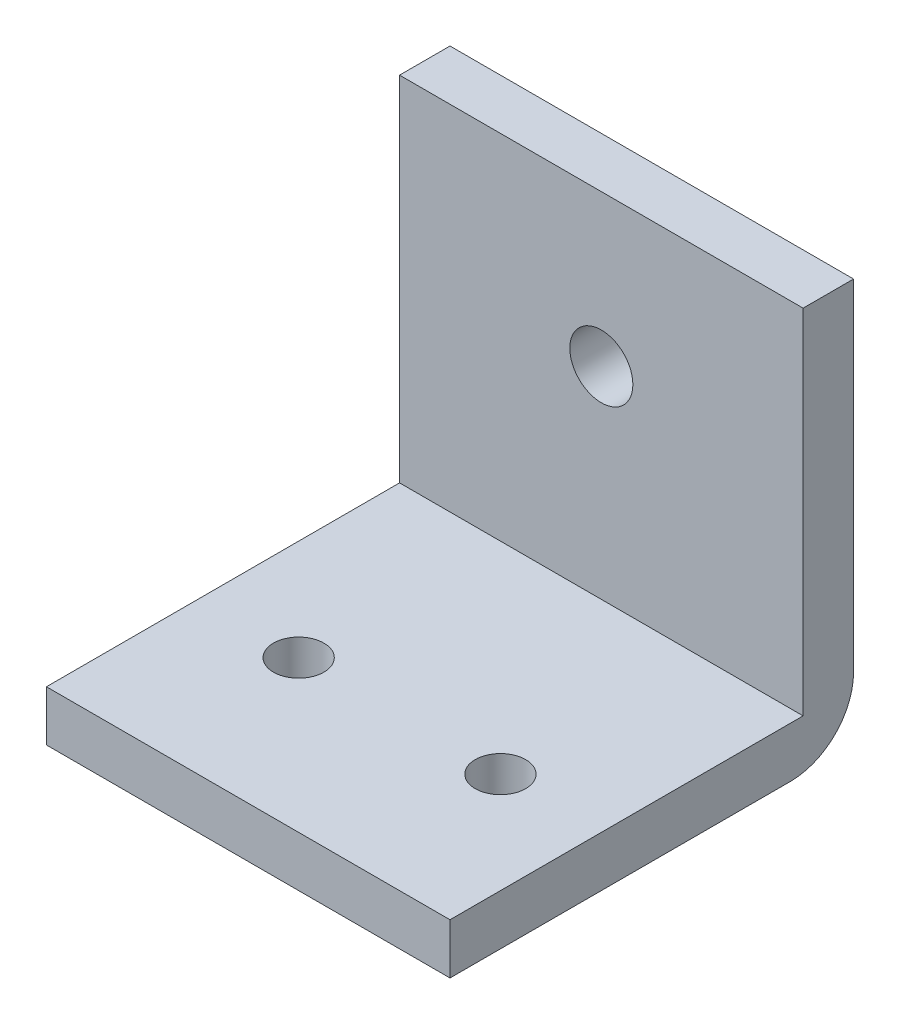
from build123d import *

# Parameters (mm, degrees)
SKETCH1_W           = 40
SKETCH1_H           = 35
SKETCH1_R           = 3.125
BOSS_EXTRUDE1_DEPTH = 5
SKETCH1_3_W         = 40
SKETCH1_3_H         = 5
BOSS_EXTRUDE2_DEPTH = 40
FILLET1_R           = 6.25
SKETCH2_R           = 2.5
CUT_EXTRUDE1_DEPTH  = 67.520673478


with BuildPart() as part:
    # Sketch1 → Boss-Extrude1 (new body)
    with BuildSketch(Plane.XY):
        with Locations((20, 22.5)):
            Rectangle(SKETCH1_W, SKETCH1_H)
        with Locations((20, 25)):
            Circle(SKETCH1_R, mode=Mode.SUBTRACT)
    extrude(amount=BOSS_EXTRUDE1_DEPTH)

    # Sketch1<3> → Boss-Extrude2 (add)
    with BuildSketch(Plane.XY):
        with Locations((20, 2.5)):
            Rectangle(SKETCH1_3_W, SKETCH1_3_H)
    extrude(amount=BOSS_EXTRUDE2_DEPTH)

    # Fillet1
    fillet1_edges = [part.edges().sort_by_distance(p)[0] for p in [
        (20, 0, 0),
    ]]
    fillet(fillet1_edges, radius=FILLET1_R)

    # Sketch2 → Cut-Extrude1 (cut, through all)
    with BuildSketch(Plane(origin=(0, 5, 0), x_dir=(1, 0, 0), z_dir=(0, 1, 0))):
        with Locations((10, -25)):
            Circle(SKETCH2_R)
        with Locations((30, -25)):
            Circle(SKETCH2_R)
    extrude(amount=-CUT_EXTRUDE1_DEPTH, mode=Mode.SUBTRACT)


solid = part.part
